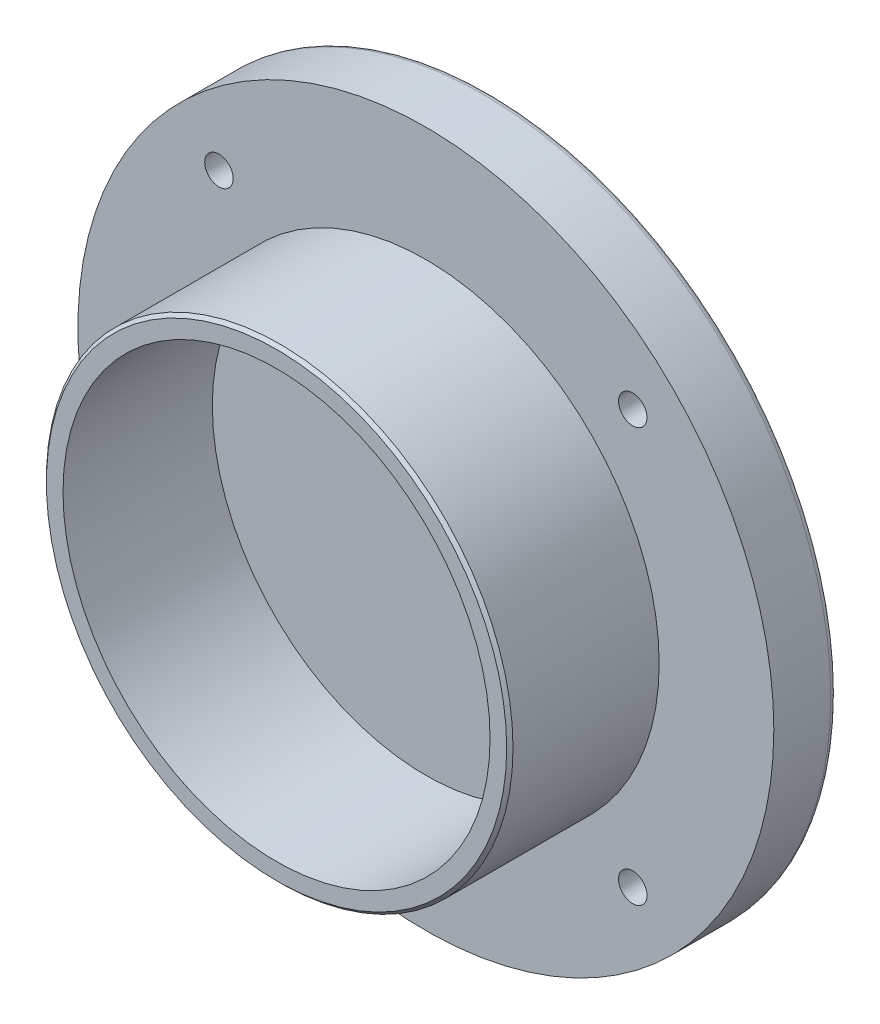
from build123d import *

# Parameters (mm, degrees)
SCHIZZO1_R                   = 110
ESTRUSIONE_ESTRUSIONE1_DEPTH = 20
SCHIZZO2_R                   = 73.75
SCHIZZO2_R_2                 = 67.5
ESTRUSIONE_ESTRUSIONE2_DEPTH = 47.2
RIPETIZIONECIRCOLARE2_COUNT  = 4
RACCORDO1_R                  = 2
SMUSSO1_SIZE                 = 1


with BuildPart() as part:
    # Schizzo1 → Estrusione-Estrusione1 (new body)
    with BuildSketch(Plane.XY):
        Circle(SCHIZZO1_R)
    extrude(amount=-ESTRUSIONE_ESTRUSIONE1_DEPTH)

    # Schizzo7 → Foro lamato per Vite M8 a testa cilindrica piana-1 (revolve, cut)
    with BuildSketch(Plane(origin=(65.40737726, 65.40737726, -20), x_dir=(0, 1, 0), z_dir=(1, 0, 0))):
        Polygon((0, 0), (0, 20), (4.5, 20), (4.5, 8), (7.5, 8), (7.5, 0), align=None)
    foro_lamato_per_vite_m8_a_testa_cilindri = revolve(axis=Axis((65.40737726, 65.40737726, -26.35), (0, 0, 1)), mode=Mode.SUBTRACT)

    # RipetizioneCircolare2: Foro lamato per Vite M8 a testa cilindrica piana-1 ×4 about axis
    ripetizionecircolare2_axis = Axis((0, 0, 0), (0, 0, 1))
    for i in range(1, RIPETIZIONECIRCOLARE2_COUNT):
        add(foro_lamato_per_vite_m8_a_testa_cilindri.rotate(ripetizionecircolare2_axis, i * 360 / RIPETIZIONECIRCOLARE2_COUNT), mode=Mode.SUBTRACT)

    # Raccordo1
    raccordo1_edges = [part.edges().sort_by_distance(p)[0] for p in [
        (-110, 0, -20),
    ]]
    fillet(raccordo1_edges, radius=RACCORDO1_R)


with BuildPart() as body_2:
    # Schizzo2 → Estrusione-Estrusione2 (new body)
    with BuildSketch(Plane.XY):
        Circle(SCHIZZO2_R)
        Circle(SCHIZZO2_R_2, mode=Mode.SUBTRACT)
    extrude(amount=ESTRUSIONE_ESTRUSIONE2_DEPTH)

    # Smusso1
    smusso1_edges = [body_2.edges().sort_by_distance(p)[0] for p in [
        (-73.75, 0, 47.2),
    ]]
    chamfer(smusso1_edges, length=SMUSSO1_SIZE)


solid = Compound([part.part, body_2.part])
